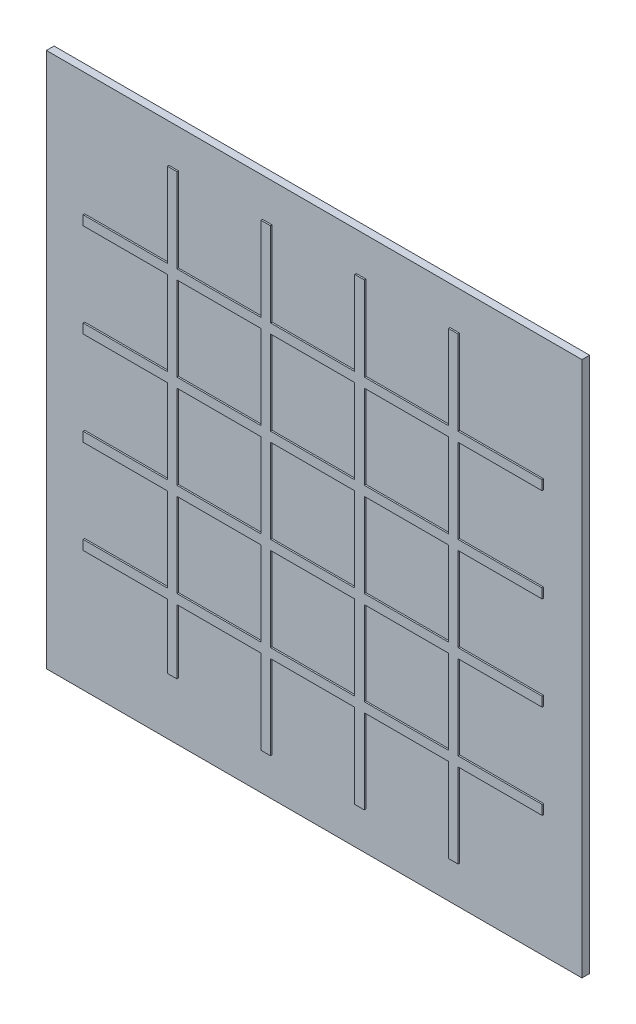
from build123d import *

# Parameters (mm, degrees)
SKETCH1_W           = 70
SKETCH1_H           = 70
BOSS_EXTRUDE1_DEPTH = 1
SKETCH3_W           = 11
SKETCH3_H           = 11
BOSS_EXTRUDE2_DEPTH = 0.2
SKETCH4_W           = 5.900984105
SKETCH4_H           = 4.163778505
CUT_EXTRUDE3_DEPTH  = 0.2


with BuildPart() as part:
    # Sketch1 → Boss-Extrude1 (new body)
    with BuildSketch(Plane.XY):
        with Locations((-31.007117438, 12.099644128)):
            Rectangle(SKETCH1_W, SKETCH1_H)
    extrude(amount=BOSS_EXTRUDE1_DEPTH)

    # Sketch3 → Boss-Extrude2 (add)
    with BuildSketch(Plane.XY.offset(1)):
        Polygon((-48.757117438, 42.099644128), (-50.007117438, 42.099644128), (-50.007117438, 31.099644128), (-61.007117438, 31.099644128), (-61.007117438, 29.849644128), (-50.007117438, 29.849644128), (-50.007117438, 18.849644128), (-61.007117438, 18.849644128), (-61.007117438, 17.599644128), (-50.007117438, 17.599644128), (-50.007117438, 6.599644128), (-61.007117438, 6.599644128), (-61.007117438, 5.349644128), (-50.007117438, 5.349644128), (-50.007117438, -5.650355872), (-61.007117438, -5.650355872), (-61.007117438, -6.900355872), (-50.007117438, -6.900355872), (-50.007117438, -17.900355872), (-48.757117438, -17.900355872), (-48.757117438, -6.900355872), (-37.757117438, -6.900355872), (-37.757117438, -17.900355872), (-36.507117438, -17.900355872), (-36.507117438, -6.900355872), (-25.507117438, -6.900355872), (-25.507117438, -17.900355872), (-24.257117438, -17.900355872), (-24.257117438, -6.900355872), (-13.257117438, -6.900355872), (-13.257117438, -17.900355872), (-12.007117438, -17.900355872), (-12.007117438, -6.900355872), (-1.007117438, -6.900355872), (-1.007117438, -5.650355872), (-12.007117438, -5.650355872), (-12.007117438, 5.349644128), (-1.007117438, 5.349644128), (-1.007117438, 6.599644128), (-12.007117438, 6.599644128), (-12.007117438, 17.599644128), (-1.007117438, 17.599644128), (-1.007117438, 18.849644128), (-12.007117438, 18.849644128), (-12.007117438, 29.849644128), (-1.007117438, 29.849644128), (-1.007117438, 31.099644128), (-12.007117438, 31.099644128), (-12.007117438, 42.099644128), (-13.257117438, 42.099644128), (-13.257117438, 31.099644128), (-24.257117438, 31.099644128), (-24.257117438, 42.099644128), (-25.507117438, 42.099644128), (-25.507117438, 31.099644128), (-36.507117438, 31.099644128), (-36.507117438, 42.099644128), (-37.757117438, 42.099644128), (-37.757117438, 31.099644128), (-48.757117438, 31.099644128), align=None)
        with Locations((-43.257117438, -0.150355872)):
            Rectangle(SKETCH3_W, SKETCH3_H, mode=Mode.SUBTRACT)
        with Locations((-31.007117438, -0.150355872)):
            Rectangle(SKETCH3_W, SKETCH3_H, mode=Mode.SUBTRACT)
        with Locations((-18.757117438, -0.150355872)):
            Rectangle(SKETCH3_W, SKETCH3_H, mode=Mode.SUBTRACT)
        with Locations((-43.257117438, 12.099644128)):
            Rectangle(SKETCH3_W, SKETCH3_H, mode=Mode.SUBTRACT)
        with Locations((-43.257117438, 24.349644128)):
            Rectangle(SKETCH3_W, SKETCH3_H, mode=Mode.SUBTRACT)
        with Locations((-31.007117438, 12.099644128)):
            Rectangle(SKETCH3_W, SKETCH3_H, mode=Mode.SUBTRACT)
        with Locations((-18.757117438, 12.099644128)):
            Rectangle(SKETCH3_W, SKETCH3_H, mode=Mode.SUBTRACT)
        with Locations((-31.007117438, 24.349644128)):
            Rectangle(SKETCH3_W, SKETCH3_H, mode=Mode.SUBTRACT)
        with Locations((-18.757117438, 24.349644128)):
            Rectangle(SKETCH3_W, SKETCH3_H, mode=Mode.SUBTRACT)
    extrude(amount=BOSS_EXTRUDE2_DEPTH)

    # Sketch4 → Cut-Extrude3 (cut)
    with BuildSketch(Plane.XY.offset(1.2)):
        with Locations((-50.439270902, -17.397627398)):
            Rectangle(SKETCH4_W, SKETCH4_H)
    extrude(amount=-CUT_EXTRUDE3_DEPTH, mode=Mode.SUBTRACT)


solid = part.part
